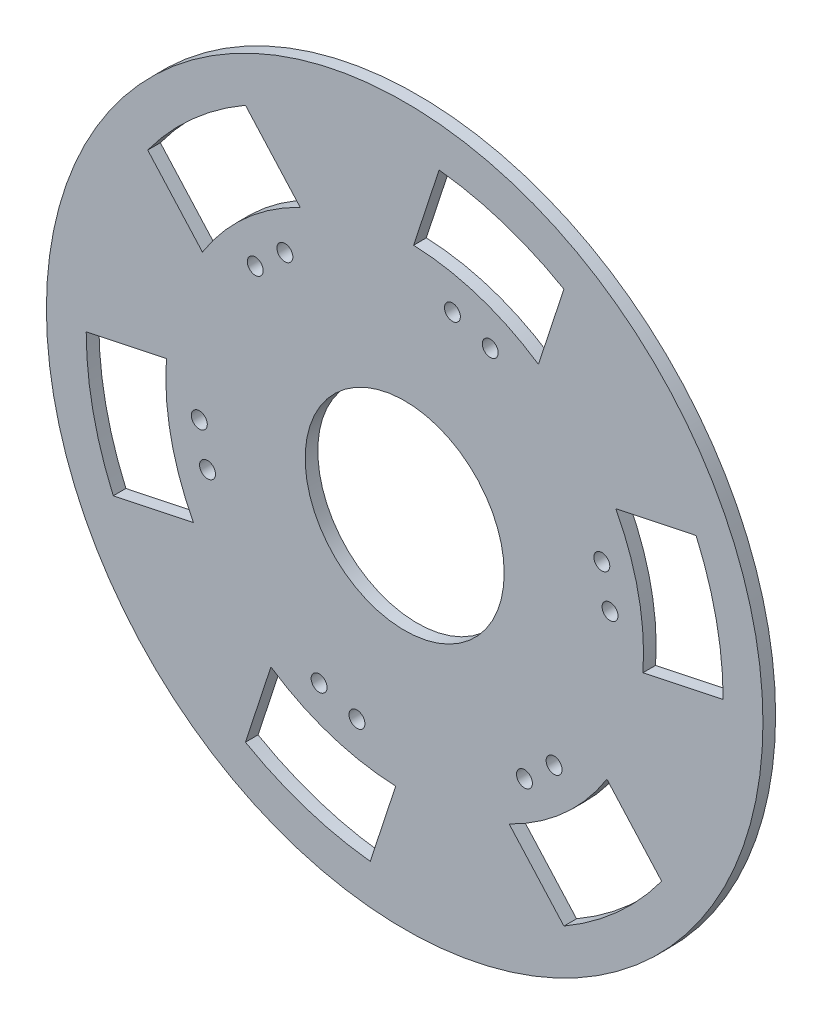
from build123d import *

# Parameters (mm, degrees)
SKETCH1_R           = 90
SKETCH1_R_2         = 25
BOSS_EXTRUDE1_DEPTH = 3.175
SKETCH2_R           = 2
CUT_EXTRUDE1_DEPTH  = 128.31881489
CUT_EXTRUDE2_DEPTH  = 128.31881489


with BuildPart() as part:
    # Sketch1 → Boss-Extrude1 (new body)
    with BuildSketch(Plane.XY):
        Circle(SKETCH1_R)
        Circle(SKETCH1_R_2, mode=Mode.SUBTRACT)
    extrude(amount=BOSS_EXTRUDE1_DEPTH)

    # Sketch2 → Cut-Extrude1 (cut, through all)
    with BuildSketch(Plane(origin=(0, 0, 0), x_dir=(-1, 0, 0), z_dir=(0, 0, -1))):
        with Locations((-49.523301376, 14.748786792)):
            Circle(SKETCH2_R)
        with Locations((-51.58474767, 4.963571456)):
            Circle(SKETCH2_R)
        with Locations((-37.534474725, -35.514043674)):
            Circle(SKETCH2_R)
        with Locations((-30.09095281, -42.191916202)):
            Circle(SKETCH2_R)
        with Locations((11.988826651, -50.262830467)):
            Circle(SKETCH2_R)
        with Locations((21.493794861, -47.155487659)):
            Circle(SKETCH2_R)
        with Locations((49.523301376, -14.748786792)):
            Circle(SKETCH2_R)
        with Locations((51.58474767, -4.963571456)):
            Circle(SKETCH2_R)
        with Locations((37.534474725, 35.514043674)):
            Circle(SKETCH2_R)
        with Locations((30.09095281, 42.191916202)):
            Circle(SKETCH2_R)
        with Locations((-21.493794861, 47.155487659)):
            Circle(SKETCH2_R)
        with Locations((-11.988826651, 50.262830467)):
            Circle(SKETCH2_R)
    extrude(amount=-CUT_EXTRUDE1_DEPTH, mode=Mode.SUBTRACT)

    # Sketch3 → Cut-Extrude2 (cut, through all)
    with BuildSketch(Plane.XY.offset(3.175)):
        Polygon((-80, 0), (-73.200702677, -32.27471344), (-55.311643355, -28.50603449), (-62.110940678, 3.76867895), align=None)
        with BuildLine():
            Line((-73.200702677, -32.27471344), (-80, 0))
            ThreePointArc((-80, 0), (-78.281722688, -16.49157036), (-73.200702677, -32.27471344))
        make_face()
        with BuildLine():
            Line((-59.849640055, 4.245065992), (-62.110940678, 3.76867895))
            Line((-62.110940678, 3.76867895), (-58.711292321, -12.368676325))
            ThreePointArc((-58.711292321, -12.368676325), (-59.859650683, -4.101489986), (-59.849640055, 4.245065992))
        make_face()
        with BuildLine():
            ThreePointArc((-53.050342732, -28.029647448), (-56.426786826, -20.396512655), (-58.711292321, -12.368676325))
            Line((-58.711292321, -12.368676325), (-55.311643355, -28.50603449))
            Line((-55.311643355, -28.50603449), (-53.050342732, -28.029647448))
        make_face()
        Polygon((-34.319242049, -51.905313005), (-2.968871648, -62.154305515), (-8.649629599, -79.531024813), (-40, -69.282032303), align=None)
        with BuildLine():
            Line((-33.601155018, -49.708775699), (-34.319242049, -51.905313005))
            Line((-34.319242049, -51.905313005), (-18.644036991, -57.029815752))
            ThreePointArc((-18.644036991, -57.029815752), (-26.377820776, -53.890728063), (-33.601155018, -49.708775699))
        make_face()
        with BuildLine():
            ThreePointArc((-2.250784617, -59.957768209), (-10.549484296, -59.065289139), (-18.644036991, -57.029815752))
            Line((-18.644036991, -57.029815752), (-2.968871648, -62.154305515))
            Line((-2.968871648, -62.154305515), (-2.250784617, -59.957768209))
        make_face()
        with BuildLine():
            Line((-8.649629599, -79.531024813), (-40, -69.282032303))
            ThreePointArc((-40, -69.282032303), (-24.858742464, -76.03974568), (-8.649629599, -79.531024813))
        make_face()
        Polygon((27.791698629, -55.673991955), (52.342771707, -33.648271025), (64.551073077, -47.256311373), (40, -69.282032303), align=None)
        with BuildLine():
            Line((26.248485037, -53.953841691), (27.791698629, -55.673991955))
            Line((27.791698629, -55.673991955), (40.067235173, -44.661131486))
            ThreePointArc((40.067235173, -44.661131486), (33.481820478, -49.789232747), (26.248485037, -53.953841691))
        make_face()
        with BuildLine():
            ThreePointArc((50.799558115, -31.928120761), (45.877291999, -38.668773951), (40.067235173, -44.661131486))
            Line((40.067235173, -44.661131486), (52.342771707, -33.648271025))
            Line((52.342771707, -33.648271025), (50.799558115, -31.928120761))
        make_face()
        with BuildLine():
            Line((64.551073077, -47.256311373), (40, -69.282032303))
            ThreePointArc((40, -69.282032303), (53.422980224, -59.54817532), (64.551073077, -47.256311373))
        make_face()
        Polygon((62.110940678, -3.76867895), (55.311643355, 28.50603449), (73.200702677, 32.27471344), (80, 0), align=None)
        with BuildLine():
            Line((58.711292095, 12.368677398), (55.311643355, 28.50603449))
            Line((55.311643355, 28.50603449), (53.050342732, 28.029647448))
            ThreePointArc((53.050342732, 28.029647448), (56.42678664, 20.39651317), (58.711292095, 12.368677398))
        make_face()
        with BuildLine():
            Line((59.849640055, -4.245065992), (62.110940678, -3.76867895))
            Line((62.110940678, -3.76867895), (58.711292095, 12.368677398))
            ThreePointArc((58.711292095, 12.368677398), (59.676953364, 6.217816108), (60, 0))
            ThreePointArc((60, 0), (59.962398231, -2.123864014), (59.849640055, -4.245065992))
        make_face()
        with BuildLine():
            ThreePointArc((80, 0), (78.281722688, 16.49157036), (73.200702677, 32.27471344))
            Line((73.200702677, 32.27471344), (80, 0))
        make_face()
        Polygon((-27.791698629, 55.673991955), (-52.342771707, 33.648271025), (-64.551073077, 47.256311373), (-40, 69.282032303), align=None)
        Polygon((34.319242049, 51.905313005), (2.968871648, 62.154305515), (8.649629599, 79.531024813), (40, 69.282032303), align=None)
        with BuildLine():
            Line((18.644056811, 57.029809272), (2.968871648, 62.154305515))
            Line((2.968871648, 62.154305515), (2.250784617, 59.957768209))
            ThreePointArc((2.250784617, 59.957768209), (10.54949456, 59.065287306), (18.644056811, 57.029809272))
        make_face()
        with BuildLine():
            Line((33.601155018, 49.708775699), (34.319242049, 51.905313005))
            Line((34.319242049, 51.905313005), (18.644056811, 57.029809272))
            ThreePointArc((18.644056811, 57.029809272), (26.37783014, 53.890723479), (33.601155018, 49.708775699))
        make_face()
        with BuildLine():
            ThreePointArc((40, 69.282032303), (24.858742464, 76.03974568), (8.649629599, 79.531024813))
            Line((8.649629599, 79.531024813), (40, 69.282032303))
        make_face()
        with BuildLine():
            ThreePointArc((-40, 69.282032303), (-53.422980224, 59.54817532), (-64.551073077, 47.256311373))
            Line((-64.551073077, 47.256311373), (-40, 69.282032303))
        make_face()
        with BuildLine():
            Line((-40.067234967, 44.661131671), (-52.342771707, 33.648271025))
            Line((-52.342771707, 33.648271025), (-50.799558115, 31.928120761))
            ThreePointArc((-50.799558115, 31.928120761), (-45.877291909, 38.668774057), (-40.067234967, 44.661131671))
        make_face()
        with BuildLine():
            Line((-26.248485037, 53.953841691), (-27.791698629, 55.673991955))
            Line((-27.791698629, 55.673991955), (-40.067234967, 44.661131671))
            ThreePointArc((-40.067234967, 44.661131671), (-33.481820363, 49.789232824), (-26.248485037, 53.953841691))
        make_face()
    extrude(amount=-CUT_EXTRUDE2_DEPTH, mode=Mode.SUBTRACT)


solid = part.part
